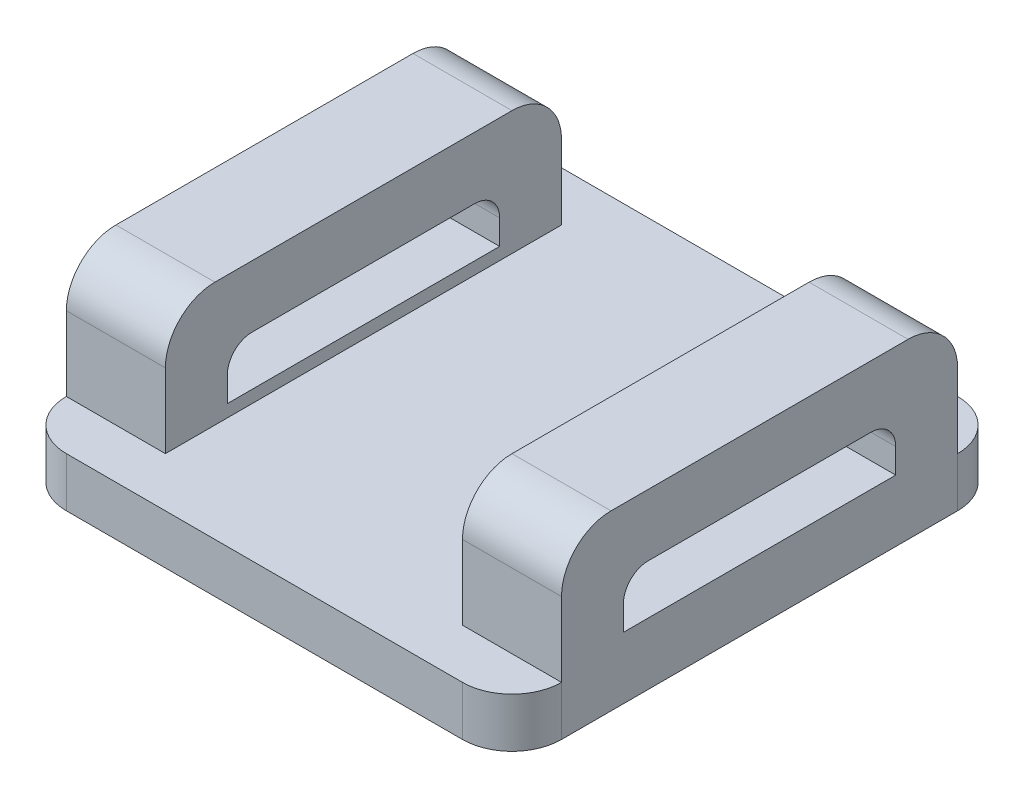
from build123d import *

# Parameters (mm, degrees)
CROQUIS1_W              = 20
CROQUIS1_H              = 20
SALIENTE_EXTRUIR1_DEPTH = 2
CROQUIS2_W              = 4
CROQUIS2_H              = 16
SALIENTE_EXTRUIR2_DEPTH = 5
CORTAR_EXTRUIR2_DEPTH   = 5
CORTAR_EXTRUIR3_START   = -5
CORTAR_EXTRUIR3_DEPTH   = 5
REDONDEO1_R             = 2
REDONDEO2_R             = 2


with BuildPart() as part:
    # Croquis1 → Saliente-Extruir1 (new body)
    with BuildSketch(Plane(origin=(0, 0, 0), x_dir=(1, 0, 0), z_dir=(0, 1, 0))):
        with Locations((-2.554744526, 1.751824818)):
            Rectangle(CROQUIS1_W, CROQUIS1_H)
    extrude(amount=SALIENTE_EXTRUIR1_DEPTH)

    # Croquis2 → Saliente-Extruir2 (add)
    with BuildSketch(Plane(origin=(0, 2, 0), x_dir=(1, 0, 0), z_dir=(0, 1, 0))):
        with Locations((-10.554744526, 1.751824818)):
            Rectangle(CROQUIS2_W, CROQUIS2_H)
        with Locations((5.445255474, 1.751824818)):
            Rectangle(CROQUIS2_W, CROQUIS2_H)
    extrude(amount=SALIENTE_EXTRUIR2_DEPTH)

    # Croquis3 → Cortar-Extruir2 (cut)
    with BuildSketch(Plane(origin=(-8.554744526, 0, 0), x_dir=(0, 0, -1), z_dir=(1, 0, 0))):
        with BuildLine():
            Line((6.251824818, 4.5), (-2.748175182, 4.5))
            ThreePointArc((-2.748175182, 4.5), (-3.455281964, 4.207106781), (-3.748175182, 3.5))
            Line((-3.748175182, 3.5), (-3.748175182, 2.5))
            Line((-3.748175182, 2.5), (7.251824818, 2.5))
            Line((7.251824818, 2.5), (7.251824818, 3.5))
            ThreePointArc((7.251824818, 3.5), (6.958931599, 4.207106781), (6.251824818, 4.5))
        make_face()
    extrude(amount=-CORTAR_EXTRUIR2_DEPTH, mode=Mode.SUBTRACT)

    # Croquis4 → Cortar-Extruir3 (cut)
    with BuildSketch(Plane.ZY.offset(-3.445255474).offset(CORTAR_EXTRUIR3_START)):
        with BuildLine():
            Line((2.748175182, 4.5), (-6.251824818, 4.5))
            ThreePointArc((-6.251824818, 4.5), (-6.958931599, 4.207106781), (-7.251824818, 3.5))
            Line((-7.251824818, 3.5), (-7.251824818, 2.5))
            Line((-7.251824818, 2.5), (3.748175182, 2.5))
            Line((3.748175182, 2.5), (3.748175182, 3.5))
            ThreePointArc((3.748175182, 3.5), (3.455281964, 4.207106781), (2.748175182, 4.5))
        make_face()
    extrude(amount=CORTAR_EXTRUIR3_DEPTH, mode=Mode.SUBTRACT)

    # Redondeo1
    redondeo1_edges = [part.edges().sort_by_distance(p)[0] for p in [
        (7.445255474, 1, -11.751824818),
        (-12.554744526, 1, -11.751824818),
        (7.445255474, 1, 8.248175182),
        (-12.554744526, 1, 8.248175182),
    ]]
    fillet(redondeo1_edges, radius=REDONDEO1_R)

    # Redondeo2
    redondeo2_edges = [part.edges().sort_by_distance(p)[0] for p in [
        (5.445255474, 7, -9.751824818),
        (5.445255474, 7, 6.248175182),
        (-10.554744526, 7, -9.751824818),
        (-10.554744526, 7, 6.248175182),
    ]]
    fillet(redondeo2_edges, radius=REDONDEO2_R)


solid = part.part
